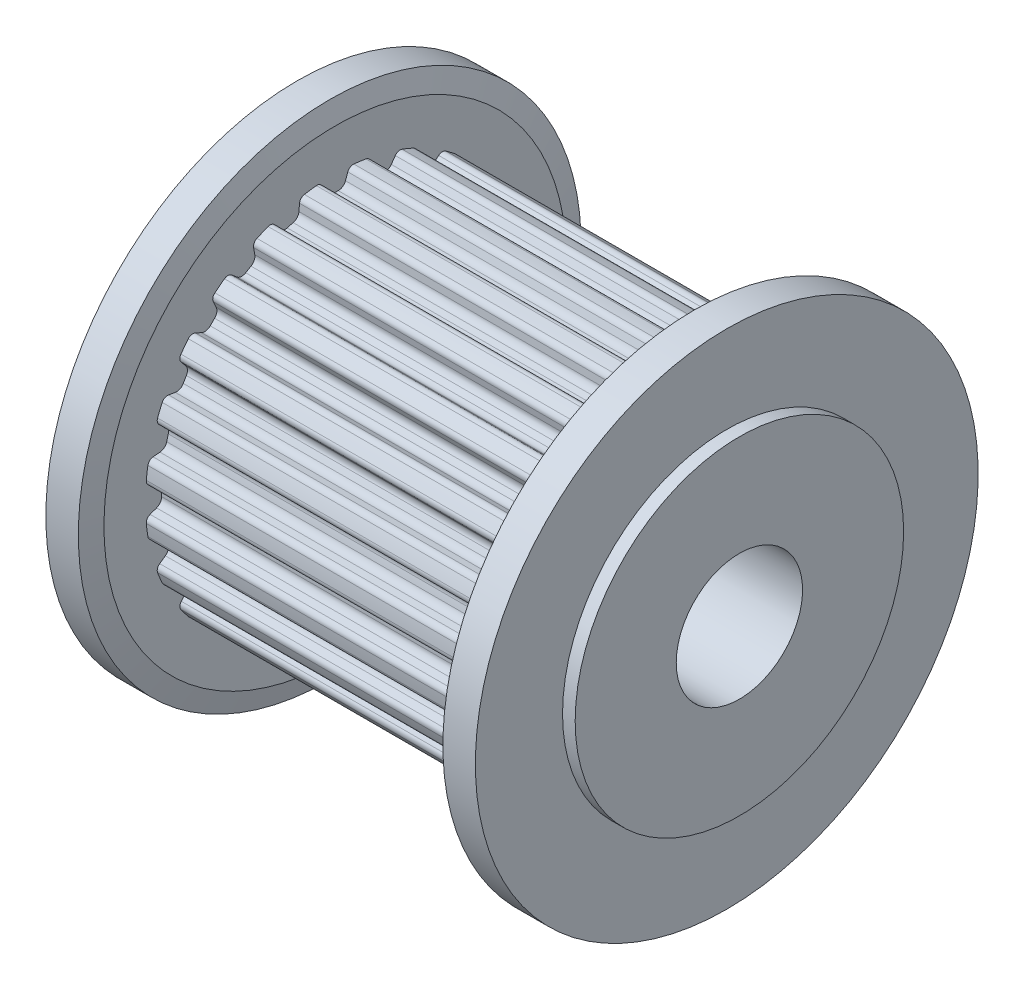
from build123d import *

# Parameters (mm, degrees)
CUT_EXTRUDE_3_DEPTH              = 7
FILLET_3_R                       = 0.23
FILLET_4_R                       = 0.3
PATTERN_CIRCULAR_2_COUNT         = 24
FILLET_3_OF_PATTERN_CIRCULAR_2_R = 0.23
FILLET_4_OF_PATTERN_CIRCULAR_2_R = 0.3
SKETCH_7_R                       = 2.5
CUT_EXTRUDE_4_DEPTH              = 23.847428739


with BuildPart() as part:
    # 草图1 → 旋转1 (revolve)
    with BuildSketch(Plane.XY, mode=Mode.PRIVATE) as revolve_1_sk:
        Polygon((-9, 6.5), (-7, 6.5), (-7, 7.51), (7, 7.51), (7, 6.5), (9, 6.5), (9, 0), (-9, 0), align=None)
    revolve(revolve_1_sk.sketch.rotate(Axis((-9, 0, 0), (1, 0, 0)), 90), axis=Axis((-9, 0, 0), (1, 0, 0)))

    # 草图3 → 切除-拉伸3 (cut, symmetric)
    with BuildSketch(Plane(origin=(0, 0, 0), x_dir=(0, 0, -1), z_dir=(1, 0, 0))):
        with BuildLine():
            Line((-0.335, 6.861827381), (-0.563217845, 7.488850757))
            ThreePointArc((-0.563217845, 7.488850757), (0, 7.51), (0.563217845, 7.488850757))
            Line((0.563217845, 7.488850757), (0.335, 6.861827381))
            ThreePointArc((0.335, 6.861827381), (0, 6.87), (-0.335, 6.861827381))
        make_face()
    cut_extrude_3 = extrude(amount=CUT_EXTRUDE_3_DEPTH, both=True, mode=Mode.SUBTRACT)

    # 圆角3
    fillet_3_edges = [part.edges().sort_by_distance(p)[0] for p in [
        (0, 7.488850757, 0.563217845),
        (0, 7.488850757, -0.563217845),
    ]]
    fillet(fillet_3_edges, radius=FILLET_3_R)

    # 圆角4
    fillet_4_edges = [part.edges().sort_by_distance(p)[0] for p in [
        (0, 6.861827381, -0.335),
        (0, 6.861827381, 0.335),
    ]]
    fillet(fillet_4_edges, radius=FILLET_4_R)

    # 阵列(圆周)2: 切除-拉伸3 ×24 about axis
    pattern_circular_2_axis = Axis((0, 0, 0), (1, 0, 0))
    for i in range(1, PATTERN_CIRCULAR_2_COUNT):
        add(cut_extrude_3.rotate(pattern_circular_2_axis, i * 360 / PATTERN_CIRCULAR_2_COUNT), mode=Mode.SUBTRACT)

    # 圆角3 of 阵列(圆周)2
    fillet_3_of_pattern_circular_2_edges = [part.edges().sort_by_distance(p)[0] for p in [
        (0, 7.08790285, 2.482283864),
        (0, 7.37944586, 1.394230539),
        (0, 6.203926078, 4.23218634),
        (0, 6.767143923, 3.256664417),
        (0, 4.897161996, 5.693672311),
        (0, 5.693672311, 4.897161996),
        (0, 3.256664417, 6.767143923),
        (0, 4.23218634, 6.203926078),
        (0, 1.394230539, 7.37944586),
        (0, 2.482283864, 7.08790285),
        (0, -0.563217845, 7.488850757),
        (0, 0.563217845, 7.488850757),
        (0, -2.482283864, 7.08790285),
        (0, -1.394230539, 7.37944586),
        (0, -4.23218634, 6.203926078),
        (0, -3.256664417, 6.767143923),
        (0, -5.693672311, 4.897161996),
        (0, -4.897161996, 5.693672311),
        (0, -6.767143923, 3.256664417),
        (0, -6.203926078, 4.23218634),
        (0, -7.37944586, 1.394230539),
        (0, -7.08790285, 2.482283864),
        (0, -7.488850757, -0.563217845),
        (0, -7.488850757, 0.563217845),
        (0, -7.08790285, -2.482283864),
        (0, -7.37944586, -1.394230539),
        (0, -6.203926078, -4.23218634),
        (0, -6.767143923, -3.256664417),
        (0, -4.897161996, -5.693672311),
        (0, -5.693672311, -4.897161996),
        (0, -3.256664417, -6.767143923),
        (0, -4.23218634, -6.203926078),
        (0, -1.394230539, -7.37944586),
        (0, -2.482283864, -7.08790285),
        (0, 0.563217845, -7.488850757),
        (0, -0.563217845, -7.488850757),
        (0, 2.482283864, -7.08790285),
        (0, 1.394230539, -7.37944586),
        (0, 4.23218634, -6.203926078),
        (0, 3.256664417, -6.767143923),
        (0, 5.693672311, -4.897161996),
        (0, 4.897161996, -5.693672311),
        (0, 6.767143923, -3.256664417),
        (0, 6.203926078, -4.23218634),
        (0, 7.37944586, -1.394230539),
        (0, 7.08790285, -2.482283864),
    ]]
    fillet(fillet_3_of_pattern_circular_2_edges, radius=FILLET_3_OF_PATTERN_CIRCULAR_2_R)

    # 圆角4 of 阵列(圆周)2
    fillet_4_of_pattern_circular_2_edges = [part.edges().sort_by_distance(p)[0] for p in [
        (0, 6.714720662, 1.452386458),
        (0, 6.541311902, 2.099556762),
        (0, 6.110016828, 3.14079518),
        (0, 5.775016828, 3.721032201),
        (0, 5.088925444, 4.6151639),
        (0, 4.6151639, 5.088925444),
        (0, 3.721032201, 5.775016828),
        (0, 3.14079518, 6.110016828),
        (0, 2.099556762, 6.541311902),
        (0, 1.452386458, 6.714720662),
        (0, 0.335, 6.861827381),
        (0, -0.335, 6.861827381),
        (0, -1.452386458, 6.714720662),
        (0, -2.099556762, 6.541311902),
        (0, -3.14079518, 6.110016828),
        (0, -3.721032201, 5.775016828),
        (0, -4.6151639, 5.088925444),
        (0, -5.088925444, 4.6151639),
        (0, -5.775016828, 3.721032201),
        (0, -6.110016828, 3.14079518),
        (0, -6.541311902, 2.099556762),
        (0, -6.714720662, 1.452386458),
        (0, -6.861827381, 0.335),
        (0, -6.861827381, -0.335),
        (0, -6.714720662, -1.452386458),
        (0, -6.541311902, -2.099556762),
        (0, -6.110016828, -3.14079518),
        (0, -5.775016828, -3.721032201),
        (0, -5.088925444, -4.6151639),
        (0, -4.6151639, -5.088925444),
        (0, -3.721032201, -5.775016828),
        (0, -3.14079518, -6.110016828),
        (0, -2.099556762, -6.541311902),
        (0, -1.452386458, -6.714720662),
        (0, -0.335, -6.861827381),
        (0, 0.335, -6.861827381),
        (0, 1.452386458, -6.714720662),
        (0, 2.099556762, -6.541311902),
        (0, 3.14079518, -6.110016828),
        (0, 3.721032201, -5.775016828),
        (0, 4.6151639, -5.088925444),
        (0, 5.088925444, -4.6151639),
        (0, 5.775016828, -3.721032201),
        (0, 6.110016828, -3.14079518),
        (0, 6.541311902, -2.099556762),
        (0, 6.714720662, -1.452386458),
    ]]
    fillet(fillet_4_of_pattern_circular_2_edges, radius=FILLET_4_OF_PATTERN_CIRCULAR_2_R)

    # 草图4 → 旋转2 (revolve)
    with BuildSketch(Plane.XY, mode=Mode.PRIVATE) as revolve_2_sk:
        Polygon((-8.5, 9.95), (-8.5, 6.5), (-7, 6.5), (-7, 9.15), (-7.214359354, 9.95), align=None)
        Polygon((8.5, 9.95), (8.5, 6.5), (7, 6.5), (7, 9.15), (7.214359354, 9.95), align=None)
    revolve(revolve_2_sk.sketch.rotate(Axis((-9, 0, 0), (1, 0, 0)), 180), axis=Axis((-9, 0, 0), (1, 0, 0)))

    # 草图7 → 切除-拉伸4 (cut, through all)
    with BuildSketch(Plane.ZY.offset(9)):
        Circle(SKETCH_7_R)
    extrude(amount=-CUT_EXTRUDE_4_DEPTH, mode=Mode.SUBTRACT)


solid = part.part
